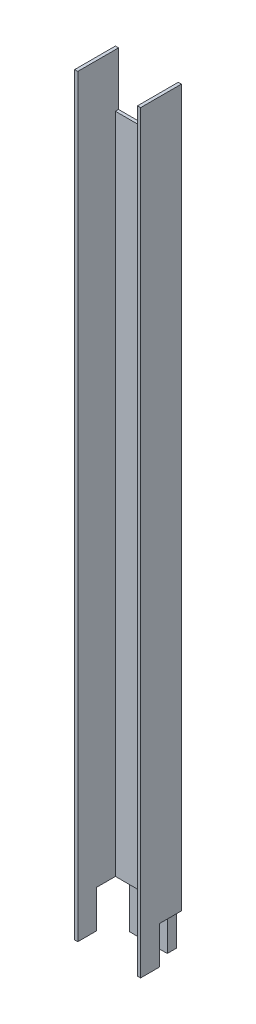
from build123d import *

# Parameters (mm, degrees)
BOSS_EXTRUDE1_DEPTH = 240
SKETCH3_W           = 19
SKETCH3_H           = 1
CUT_EXTRUDE1_DEPTH  = 17
SKETCH4_W           = 19
SKETCH4_H           = 1
CUT_EXTRUDE2_DEPTH  = 11
SKETCH5_W           = 12
SKETCH5_H           = 30
BOSS_EXTRUDE2_DEPTH = 3
SKETCH6_W           = 12
SKETCH6_H           = 3
BOSS_EXTRUDE3_DEPTH = 13
SKETCH7_W           = 7
SKETCH7_H           = 12
CUT_EXTRUDE3_DEPTH  = 30


with BuildPart() as part:
    # Sketch2 → Boss-Extrude1 (new body)
    with BuildSketch(Plane(origin=(0, 0, 0), x_dir=(1, 0, 0), z_dir=(0, 1, 0))):
        Polygon((-10.5, -6.5), (-10.5, 6.5), (10.5, 6.5), (10.5, -6.5), (9.5, -6.5), (9.5, 5.5), (-9.5, 5.5), (-9.5, -6.5), align=None)
    extrude(amount=BOSS_EXTRUDE1_DEPTH)

    # Sketch3 → Cut-Extrude1 (cut)
    with BuildSketch(Plane(origin=(0, 240, 0), x_dir=(1, 0, 0), z_dir=(0, 1, 0))):
        with Locations((0, 6)):
            Rectangle(SKETCH3_W, SKETCH3_H)
    extrude(amount=-CUT_EXTRUDE1_DEPTH, mode=Mode.SUBTRACT)

    # Sketch4 → Cut-Extrude2 (cut)
    with BuildSketch(Plane.XZ):
        with Locations((0, -6)):
            Rectangle(SKETCH4_W, SKETCH4_H)
    extrude(amount=-CUT_EXTRUDE2_DEPTH, mode=Mode.SUBTRACT)

    # Sketch5 → Boss-Extrude2 (add)
    with BuildSketch(Plane(origin=(0, 0, -6.5), x_dir=(-1, 0, 0), z_dir=(0, 0, -1))):
        with Locations((0, 26)):
            Rectangle(SKETCH5_W, SKETCH5_H)
    extrude(amount=BOSS_EXTRUDE2_DEPTH)

    # Sketch6 → Boss-Extrude3 (add)
    with BuildSketch(Plane.XZ.offset(-11)):
        with Locations((0, -8)):
            Rectangle(SKETCH6_W, SKETCH6_H)
    extrude(amount=BOSS_EXTRUDE3_DEPTH)

    # Sketch7 → Cut-Extrude3 (cut)
    with BuildSketch(Plane(origin=(10.5, 0, 0), x_dir=(0, 0, -1), z_dir=(1, 0, 0))):
        with Locations((3, 6)):
            Rectangle(SKETCH7_W, SKETCH7_H)
    extrude(amount=-CUT_EXTRUDE3_DEPTH, mode=Mode.SUBTRACT)


solid = part.part
